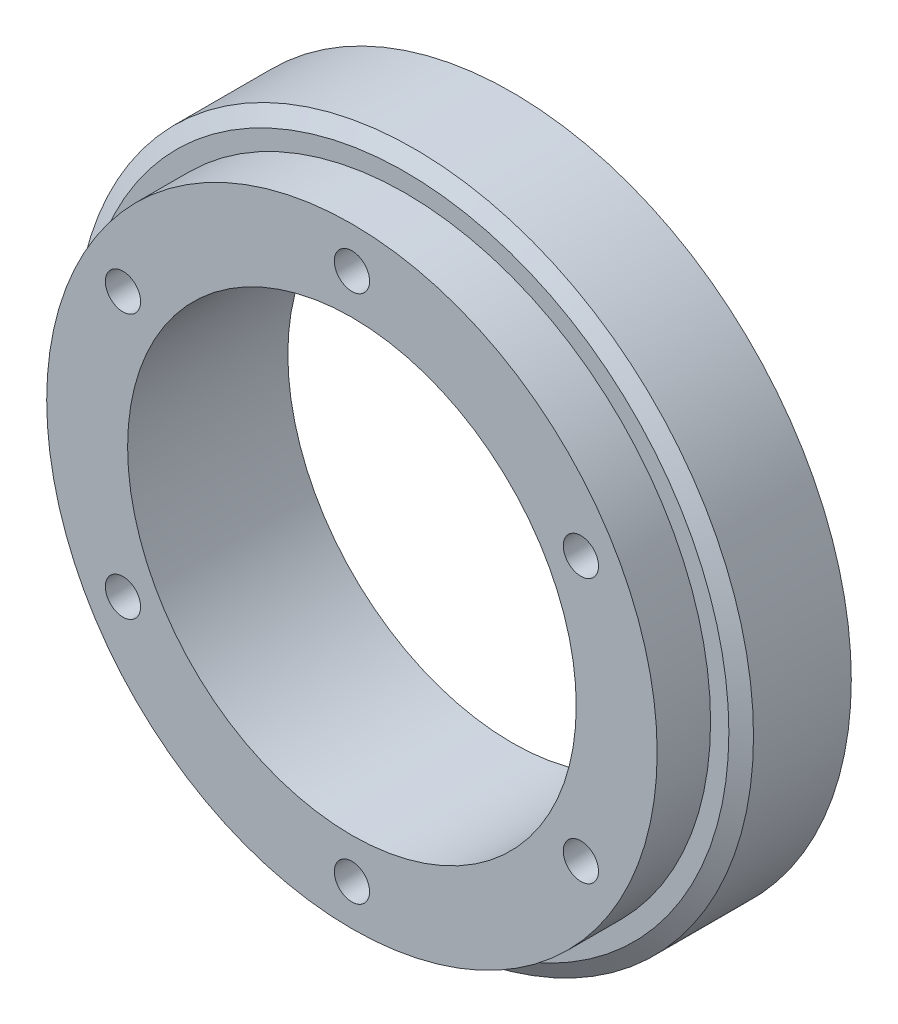
from build123d import *

# Parameters (mm, degrees)
M4X0_7_TAPPED_HOLE1_D = 3.3
CIRPATTERN1_COUNT     = 6


with BuildPart() as part:
    # Sketch1 → Revolve1 (revolve)
    with BuildSketch(Plane(origin=(0, 0, 0), x_dir=(0, 0, -1), z_dir=(1, 0, 0)), mode=Mode.PRIVATE) as revolve1_sk:
        Polygon((0, 31.75), (-9.155682966, 31.75), (-10, 30.2876), (-10, 28.575), (-15, 28.575), (-15, 21), (0, 21), align=None)
    revolve(revolve1_sk.sketch.rotate(Axis((0, 0, 15), (0, 0, -1)), 90), axis=Axis((0, 0, 15), (0, 0, -1)))

    # M4x0.7 Tapped Hole1 (through all)
    with Locations(Plane(origin=(0, 0, 0), x_dir=(-1, 0, 0), z_dir=(0, 0, -1))):
        with Locations((0, 24.75)):
            m4x0_7_tapped_hole1 = Hole(M4X0_7_TAPPED_HOLE1_D / 2)

    # CirPattern1: M4x0.7 Tapped Hole1 ×6 about axis
    cirpattern1_axis = Axis((0, 0, 0), (0, 0, 1))
    for i in range(1, CIRPATTERN1_COUNT):
        add(m4x0_7_tapped_hole1.rotate(cirpattern1_axis, i * 360 / CIRPATTERN1_COUNT), mode=Mode.SUBTRACT)


solid = part.part
